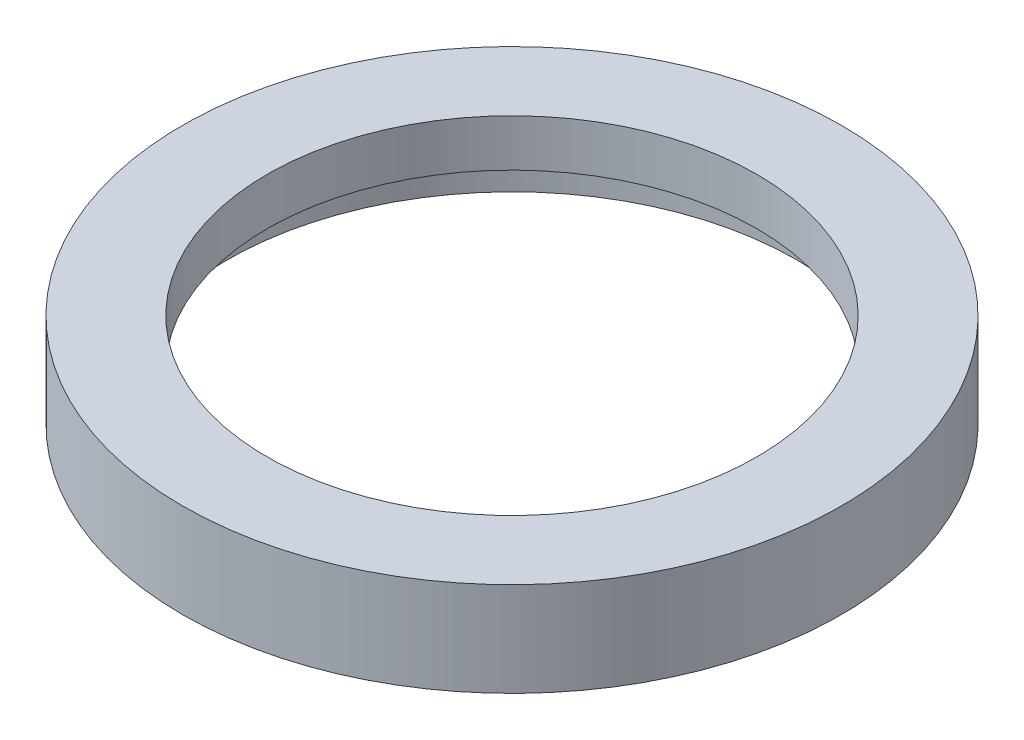
from build123d import *

# Parameters (mm, degrees)
SKETCH1_W   = 9
SKETCH1_H   = 5
SKETCH1_W_2 = 4.75


with BuildPart() as part:
    # Sketch1 → Revolve1 (revolve)
    with BuildSketch(Plane.XY, mode=Mode.PRIVATE) as revolve1_sk:
        with Locations((-30.5, 2.5)):
            Rectangle(SKETCH1_W, SKETCH1_H)
        with Locations((-32.625, -2.5)):
            Rectangle(SKETCH1_W_2, SKETCH1_H)
    revolve(revolve1_sk.sketch.rotate(Axis((0, 0, 0), (0, 1, 0)), 270), axis=Axis((0, 0, 0), (0, 1, 0)))


solid = part.part
